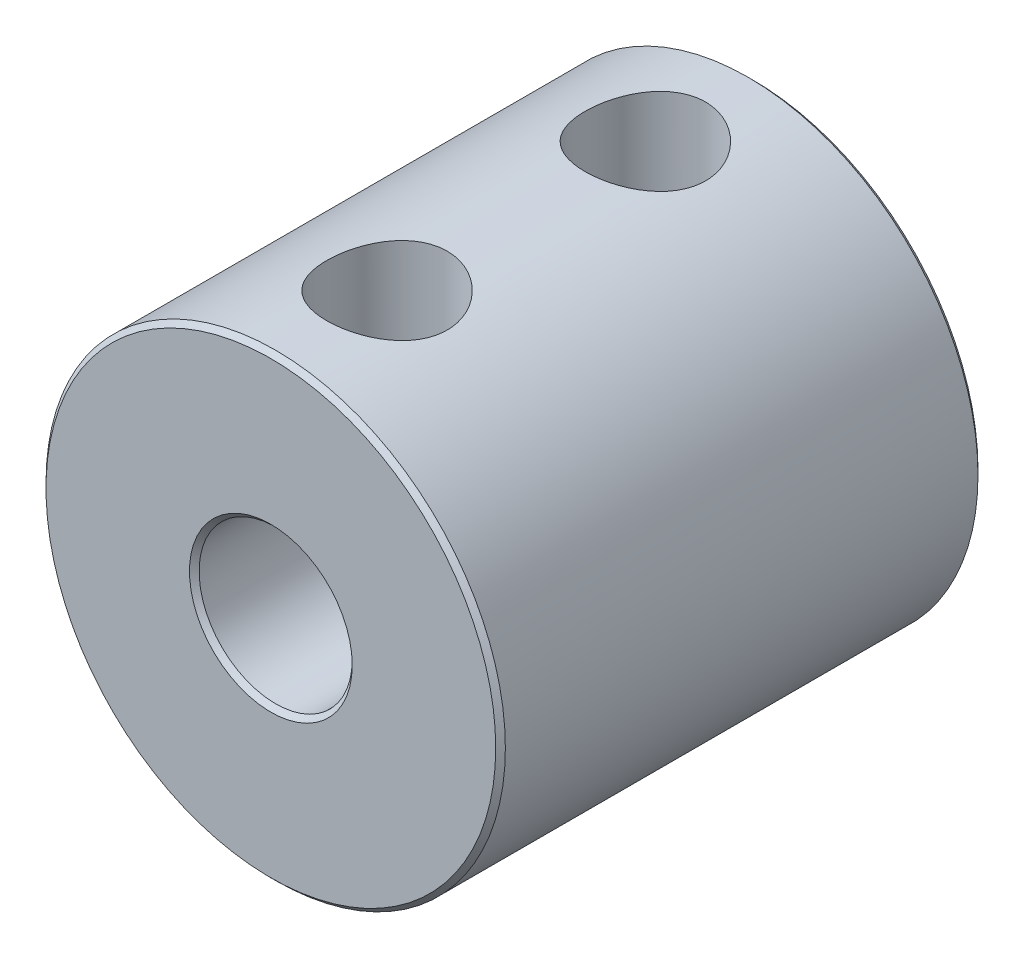
from build123d import *

# Parameters (mm, degrees)
SKETCH1_R                      = 4.7625
SKETCH1_R_2                    = 1.5875
BOSS_EXTRUDE1_DEPTH            = 5
BOSS_EXTRUDE2_START            = -5
SKETCH1_3_R                    = 4.7625
SKETCH1_3_R_2                  = 2
BOSS_EXTRUDE2_DEPTH            = 5
SKETCH3_W                      = 1.25
SKETCH3_H                      = 4.7625
M3X0_5_TAPPED_HOLE1_AT_2_COUNT = 2
M3X0_5_TAPPED_HOLE1_AT_2_PITCH = 5.356303923
CHAMFER1_SIZE                  = 0.1


with BuildPart() as part:
    # Sketch1 → Boss-Extrude1 (new body)
    with BuildSketch(Plane.XY):
        Circle(SKETCH1_R)
        Circle(SKETCH1_R_2, mode=Mode.SUBTRACT)
    extrude(amount=BOSS_EXTRUDE1_DEPTH)

    # Sketch1<3> → Boss-Extrude2 (add)
    with BuildSketch(Plane.XY.offset(BOSS_EXTRUDE2_START)):
        Circle(SKETCH1_3_R)
        Circle(SKETCH1_3_R_2, mode=Mode.SUBTRACT)
    extrude(amount=BOSS_EXTRUDE2_DEPTH)

    # Sketch3 → M3x0.5 Tapped Hole1 (revolve, cut)
    with BuildSketch(Plane(origin=(0, 0, 2.591545057), x_dir=(0, 0, -1), z_dir=(1, 0, 0))):
        with Locations((0.625, 2.38125)):
            Rectangle(SKETCH3_W, SKETCH3_H)
    m3x0_5_tapped_hole1 = revolve(axis=Axis((0, -6.35, 2.591545057), (0, 1, 0)), mode=Mode.SUBTRACT)

    # M3x0.5 Tapped Hole1 at 2: M3x0.5 Tapped Hole1 ×2
    with Locations(*[(0, 0, -i * M3X0_5_TAPPED_HOLE1_AT_2_PITCH) for i in range(1, M3X0_5_TAPPED_HOLE1_AT_2_COUNT)]):
        add(m3x0_5_tapped_hole1, mode=Mode.SUBTRACT)

    # Chamfer1
    chamfer1_edges = [part.edges().sort_by_distance(p)[0] for p in [
        (-4.7625, 0, -5),
        (-2, 0, -5),
        (-1.5875, 0, 5),
        (-4.7625, 0, 5),
    ]]
    chamfer(chamfer1_edges, length=CHAMFER1_SIZE)


solid = part.part
